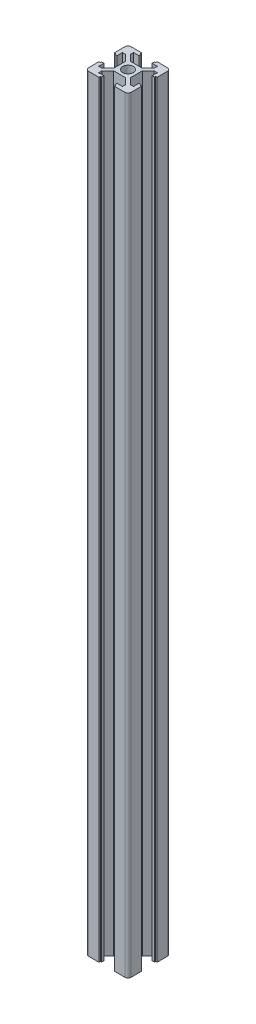
from build123d import *

# Parameters (mm, degrees)
SKETCH_1_R      = 2.5
EXTRUDE_1_DEPTH = 360
FILLET_1_R      = 1.5


with BuildPart() as part:
    # 草图1 → 凸台-拉伸1 (new body)
    with BuildSketch(Plane(origin=(0, 0, 0), x_dir=(1, 0, 0), z_dir=(0, 1, 0))):
        Polygon((10, 10), (3.65, 10), (3.65, 9.303257497), (3.1, 9.303257497), (3.1, 8.2), (5.6, 8.2), (5.6, 6.660660172), (2.839339828, 3.9), (-2.839339828, 3.9), (-5.6, 6.660660172), (-5.6, 8.2), (-3.1, 8.2), (-3.1, 9.303257497), (-3.65, 9.303257497), (-3.65, 10), (-10, 10), (-10, 3.65), (-9.303257497, 3.65), (-9.303257497, 3.1), (-8.2, 3.1), (-8.2, 5.6), (-6.660660172, 5.6), (-3.9, 2.839339828), (-3.9, -2.839339828), (-6.660660172, -5.6), (-8.2, -5.6), (-8.2, -3.1), (-9.303257497, -3.1), (-9.303257497, -3.65), (-10, -3.65), (-10, -10), (-3.65, -10), (-3.65, -9.303257497), (-3.1, -9.303257497), (-3.1, -8.2), (-5.6, -8.2), (-5.6, -6.660660172), (-2.839339828, -3.9), (2.839339828, -3.9), (5.6, -6.660660172), (5.6, -8.2), (3.1, -8.2), (3.1, -9.303257497), (3.65, -9.303257497), (3.65, -10), (10, -10), (10, -3.65), (9.303257497, -3.65), (9.303257497, -3.1), (8.2, -3.1), (8.2, -5.6), (6.660660172, -5.6), (3.9, -2.839339828), (3.9, 2.839339828), (6.660660172, 5.6), (8.2, 5.6), (8.2, 3.1), (9.303257497, 3.1), (9.303257497, 3.65), (10, 3.65), align=None)
        with Locations(Location((0, 0, 0), (0, 0, 90))):
            Circle(SKETCH_1_R, mode=Mode.SUBTRACT)
    extrude(amount=EXTRUDE_1_DEPTH)

    # 圆角1
    fillet_1_edges = [part.edges().sort_by_distance(p)[0] for p in [
        (10, 180, 10),
        (-10, 180, 10),
        (-10, 180, -10),
        (10, 180, -10),
    ]]
    fillet(fillet_1_edges, radius=FILLET_1_R)


solid = part.part
